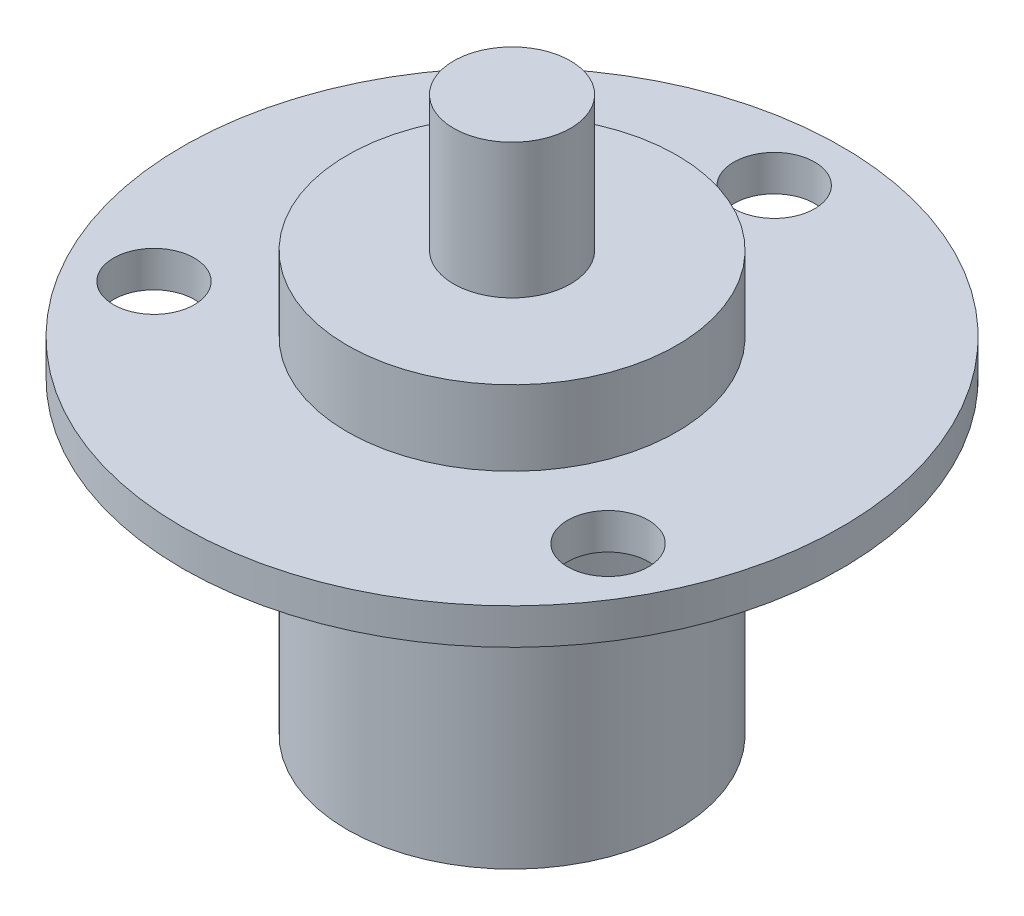
from build123d import *

# Parameters (mm, degrees)
SKETCH1_R           = 22
BOSS_EXTRUDE1_DEPTH = 2.4
SKETCH2_R           = 11
BOSS_EXTRUDE2_DEPTH = 5
SKETCH3_R           = 3.9
BOSS_EXTRUDE3_DEPTH = 9
BOSS_EXTRUDE4_START = 20.6
SKETCH4_R           = 11
BOSS_EXTRUDE4_DEPTH = 20.6
SKETCH5_R           = 2.7
CUT_EXTRUDE1_DEPTH  = 39.691084244


with BuildPart() as part:
    # Sketch1 → Boss-Extrude1 (new body)
    with BuildSketch(Plane(origin=(0, 0, 0), x_dir=(1, 0, 0), z_dir=(0, 1, 0))):
        with Locations(Location((0, 0, 0), (0, 0, 270))):
            Circle(SKETCH1_R)
    extrude(amount=BOSS_EXTRUDE1_DEPTH)

    # Sketch2 → Boss-Extrude2 (add)
    with BuildSketch(Plane(origin=(0, 2.4, 0), x_dir=(1, 0, 0), z_dir=(0, 1, 0))):
        with Locations(Location((0, 0, 0), (0, 0, 270))):
            Circle(SKETCH2_R)
    extrude(amount=BOSS_EXTRUDE2_DEPTH)

    # Sketch3 → Boss-Extrude3 (add)
    with BuildSketch(Plane(origin=(0, 7.4, 0), x_dir=(1, 0, 0), z_dir=(0, 1, 0))):
        with Locations(Location((0, 0, 0), (0, 0, 270))):
            Circle(SKETCH3_R)
    extrude(amount=BOSS_EXTRUDE3_DEPTH)

    # Sketch4 → Boss-Extrude4 (add)
    with BuildSketch(Plane.XZ.offset(BOSS_EXTRUDE4_START)):
        with Locations(Location((0, 0, 0), (0, 0, 90))):
            Circle(SKETCH4_R)
    extrude(amount=-BOSS_EXTRUDE4_DEPTH)

    # Sketch5 → Cut-Extrude1 (cut, through all)
    with BuildSketch(Plane(origin=(0, 2.4, 0), x_dir=(1, 0, 0), z_dir=(0, 1, 0))):
        with Locations(Location((0, 17.5, 0), (0, 0, 270))):
            Circle(SKETCH5_R)
        with Locations(Location((-15.155444566, -8.75, 0), (0, 0, 270))):
            Circle(SKETCH5_R)
        with Locations(Location((15.155444566, -8.75, 0), (0, 0, 270))):
            Circle(SKETCH5_R)
    extrude(amount=-CUT_EXTRUDE1_DEPTH, mode=Mode.SUBTRACT)


solid = part.part
